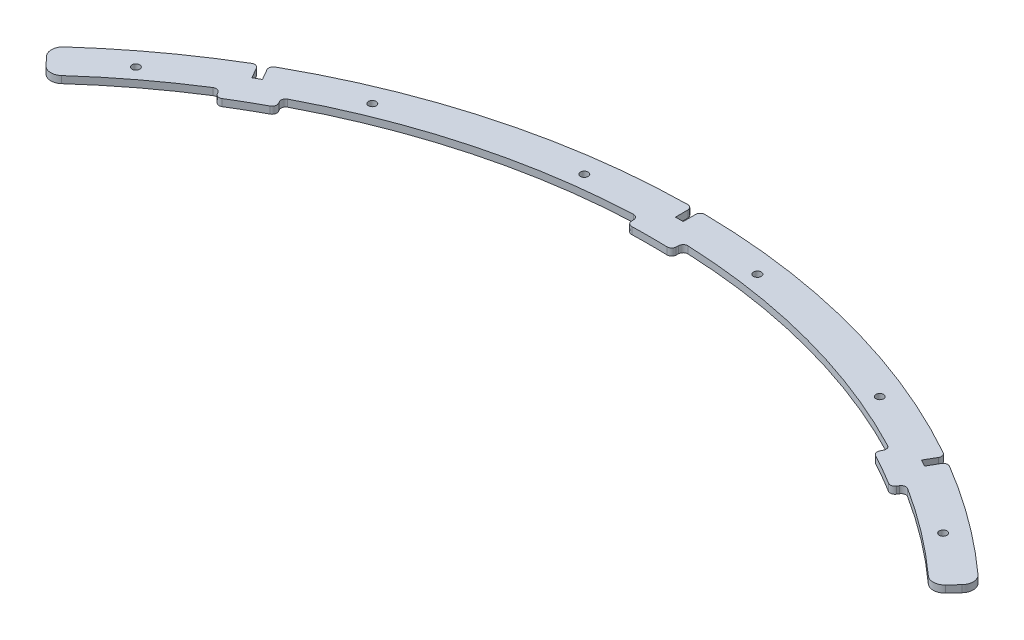
from build123d import *

# Parameters (mm, degrees)
BOSS_EXTRUDE1_DEPTH = 3
FILLET1_R           = 2
FILLET2_R           = 2
FILLET3_R           = 2
BOSS_EXTRUDE2_START = -3
BOSS_EXTRUDE2_DEPTH = 3
FILLET4_R           = 2
SKETCH3_R           = 1.65
CUT_EXTRUDE1_DEPTH  = 10


with BuildPart() as part:
    # Sketch1 → Boss-Extrude1 (new body)
    with BuildSketch(Plane(origin=(0, 0, 0), x_dir=(1, 0, 0), z_dir=(0, 1, 0))):
        with BuildLine():
            Line((-147.176606992, 251.617360996), (-143.528941916, 245.299419756))
            Line((-143.528941916, 245.299419756), (-140.671058084, 246.949419756))
            Line((-140.671058084, 246.949419756), (-144.318723159, 253.267360996))
            ThreePointArc((-144.318723159, 253.267360996), (-75.445751647, 281.567378363), (-1.65, 291.495330151))
            Line((-1.65, 291.495330151), (-1.65, 284.2))
            Line((-1.65, 284.2), (1.65, 284.2))
            Line((1.65, 284.2), (1.65, 291.495330151))
            ThreePointArc((1.65, 291.495330151), (75.445751647, 281.567378363), (144.318723159, 253.267360996))
            Line((144.318723159, 253.267360996), (140.671058084, 246.949419756))
            Line((140.671058084, 246.949419756), (143.528941916, 245.299419756))
            Line((143.528941916, 245.299419756), (147.176606992, 251.617360996))
            ThreePointArc((147.176606992, 251.617360996), (150.840163403, 249.438359329), (154.471465524, 247.20602003))
            Line((154.471465524, 247.20602003), (143.873080239, 230.245058106))
            ThreePointArc((143.873080239, 230.245058106), (135.75, 235.125897127), (127.461529296, 239.720271461))
            Line((127.461529296, 239.720271461), (129.80888711, 244.135009425))
            ThreePointArc((129.80888711, 244.135009425), (71.563465971, 267.078490969), (9.649710838, 276.331563671))
            Line((9.649710838, 276.331563671), (9.475213355, 271.334609536))
            ThreePointArc((9.475213355, 271.334609536), (0, 271.5), (-9.475213355, 271.334609536))
            Line((-9.475213355, 271.334609536), (-9.649710838, 276.331563671))
            ThreePointArc((-9.649710838, 276.331563671), (-71.563465971, 267.078490969), (-129.80888711, 244.135009425))
            Line((-129.80888711, 244.135009425), (-127.461529296, 239.720271461))
            ThreePointArc((-127.461529296, 239.720271461), (-135.75, 235.125897127), (-143.873080239, 230.245058106))
            Line((-143.873080239, 230.245058106), (-154.471465524, 247.20602003))
            ThreePointArc((-154.471465524, 247.20602003), (-150.840163403, 249.438359329), (-147.176606992, 251.617360996))
        make_face()
    extrude(amount=BOSS_EXTRUDE1_DEPTH)

    # Fillet1
    fillet1_edges = [part.edges().sort_by_distance(p)[0] for p in [
        (127.461529296, 1.5, -239.720271461),
        (129.80888711, 1.5, -244.135009425),
        (9.649710838, 1.5, -276.331563671),
        (9.475213355, 1.5, -271.334609536),
        (-9.475213355, 1.5, -271.334609536),
        (-9.649710838, 1.5, -276.331563671),
        (-129.80888711, 1.5, -244.135009425),
        (-127.461529296, 1.5, -239.720271461),
    ]]
    fillet(fillet1_edges, radius=FILLET1_R)

    # Fillet2
    fillet2_edges = [part.edges().sort_by_distance(p)[0] for p in [
        (154.471465524, 1.5, -247.20602003),
        (143.873080239, 1.5, -230.245058106),
        (-143.873080239, 1.5, -230.245058106),
        (-154.471465524, 1.5, -247.20602003),
    ]]
    fillet(fillet2_edges, radius=FILLET2_R)

    # Fillet3
    fillet3_edges = [part.edges().sort_by_distance(p)[0] for p in [
        (-147.176606992, 1.5, -251.617360996),
        (-144.318723159, 1.5, -253.267360996),
        (-1.65, 1.5, -291.495330151),
        (1.65, 1.5, -291.495330151),
        (144.318723159, 1.5, -253.267360996),
        (147.176606992, 1.5, -251.617360996),
    ]]
    fillet(fillet3_edges, radius=FILLET3_R)

    # Sketch2 → Boss-Extrude2 (add)
    with BuildSketch(Plane(origin=(0, 3, 0), x_dir=(1, 0, 0), z_dir=(0, 1, 0)).offset(BOSS_EXTRUDE2_START)):
        with BuildLine():
            Line((-152.759965651, 248.267281159), (-146.52267656, 234.485298587))
            ThreePointArc((-146.52267656, 234.485298587), (-166.367665138, 220.84847746), (-184.950980973, 205.536820636))
            ThreePointArc((-184.950980973, 205.536820636), (-188.514353616, 204.258373219), (-191.95225185, 205.843588702))
            Line((-191.95225185, 205.843588702), (-195.362772292, 209.500924109))
            ThreePointArc((-195.362772292, 209.500924109), (-196.701244935, 213.129011848), (-195.0516583, 216.6266387))
            ThreePointArc((-195.0516583, 216.6266387), (-174.623921622, 233.406803666), (-152.759965651, 248.267281159))
        make_face()
        with BuildLine():
            Line((191.95225185, 205.843588702), (195.362772292, 209.500924109))
            ThreePointArc((195.362772292, 209.500924109), (196.701244935, 213.129011848), (195.0516583, 216.6266387))
            ThreePointArc((195.0516583, 216.6266387), (174.623921622, 233.406803666), (152.759965651, 248.267281159))
            Line((152.759965651, 248.267281159), (146.52267656, 234.485298587))
            ThreePointArc((146.52267656, 234.485298587), (166.367665138, 220.84847746), (184.950980973, 205.536820636))
            ThreePointArc((184.950980973, 205.536820636), (188.514353616, 204.258373219), (191.95225185, 205.843588702))
        make_face()
    extrude(amount=BOSS_EXTRUDE2_DEPTH)

    # Fillet4
    fillet4_edges = [part.edges().sort_by_distance(p)[0] for p in [
        (-146.52267656, 1.5, -234.485298587),
        (146.52267656, 1.5, -234.485298587),
    ]]
    fillet(fillet4_edges, radius=FILLET4_R)

    # Sketch3 → Cut-Extrude1 (cut)
    with BuildSketch(Plane(origin=(0, 3, 0), x_dir=(1, 0, 0), z_dir=(0, 1, 0))):
        with Locations(Location((-36.938912398, 280.578895769, 0), (0, 0, 270))):
            Circle(SKETCH3_R)
        with Locations(Location((36.938912398, 280.578895769, 0), (0, 0, 270))):
            Circle(SKETCH3_R)
        with Locations(Location((108.299411359, 261.457907701, 0), (0, 0, 270))):
            Circle(SKETCH3_R)
        with Locations(Location((-108.299411359, 261.457907701, 0), (0, 0, 270))):
            Circle(SKETCH3_R)
        with Locations(Location((172.279484409, 224.518995302, 0), (0, 0, 270))):
            Circle(SKETCH3_R)
        with Locations(Location((-172.279484409, 224.518995302, 0), (0, 0, 270))):
            Circle(SKETCH3_R)
    extrude(amount=-CUT_EXTRUDE1_DEPTH, mode=Mode.SUBTRACT)


solid = part.part
